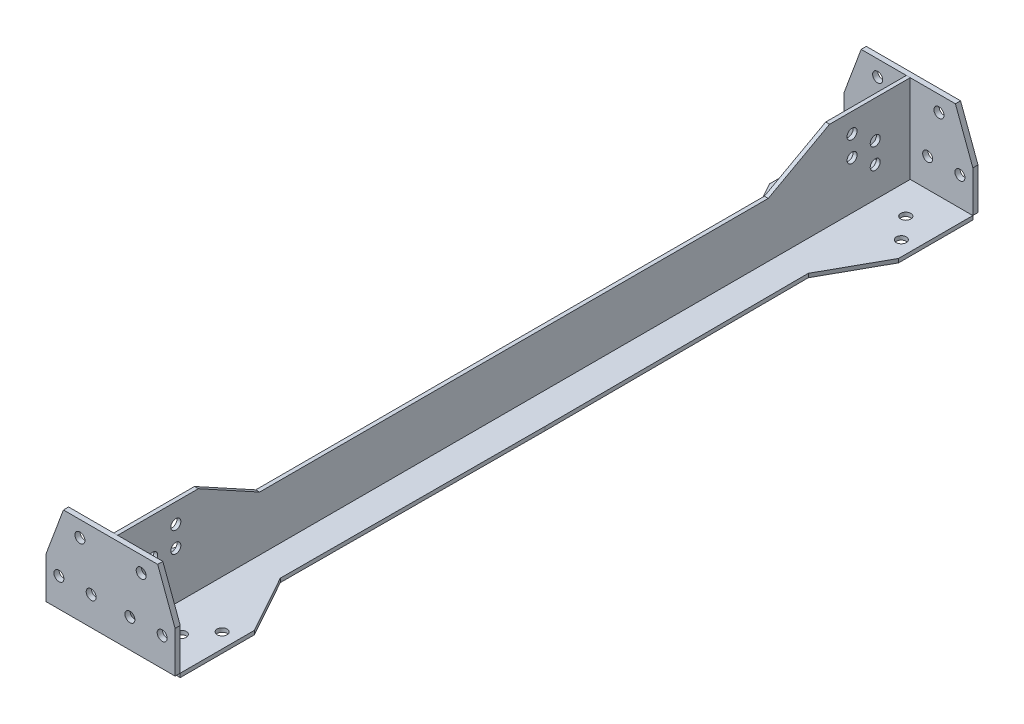
from build123d import *

# Parameters (mm, degrees)
EXTRUDE_1_DEPTH     = 1228
EXTRUDE_2_DEPTH     = 16
SKETCH_5_R          = 15.5
CUT_EXTRUDE_3_DEPTH = 1290.210999022
SKETCH_6_R          = 15.5
CUT_EXTRUDE_4_DEPTH = 1292.438345412
SKETCH_7_R          = 15.5
CUT_EXTRUDE_6_DEPTH = 1291.494866321


with BuildPart() as part:
    # 草图2 → 拉伸1 (new body)
    with BuildSketch(Plane.XY):
        Polygon((-200, -6), (200, -6), (200, 6), (6, 6), (6, 279), (-6, 279), (-6, 6), (-200, 6), align=None)
    extrude(amount=EXTRUDE_1_DEPTH)

    # 草图5 → 拉伸3 (cut, through all)
    with BuildSketch(Plane(origin=(0, 6, 0), x_dir=(-1, 0, 0), z_dir=(0, 1, 0))):
        with Locations((-97.738221798, 1122.413652083)):
            Circle(SKETCH_5_R)
        with Locations((-154.125657451, 1052.267682131)):
            Circle(SKETCH_5_R)
        with Locations((154.125657451, 1052.267682131)):
            Circle(SKETCH_5_R)
        with Locations((97.738221798, 1122.413652083)):
            Circle(SKETCH_5_R)
        Polygon((-200, 0), (-200, 998), (-100, 818), (-103, 0), align=None)
        Polygon((200, 998), (100, 818), (103, 0), (200, 0), align=None)
    extrude(amount=-CUT_EXTRUDE_3_DEPTH, mode=Mode.SUBTRACT)

    # 草图6 → 拉伸4 (cut, through all)
    with BuildSketch(Plane(origin=(6, 0, 0), x_dir=(0, 0, -1), z_dir=(1, 0, 0))):
        with Locations(Location((-1119.516620303, 164.02067953, 0), (0, 0, 90))):
            Circle(SKETCH_6_R)
        with Locations(Location((-1047.699285862, 218.263379258, 0), (0, 0, 90))):
            Circle(SKETCH_6_R)
        with Locations(Location((-1119.516620303, 100.02067953, 0), (0, 0, 90))):
            Circle(SKETCH_6_R)
        with Locations(Location((-1047.699285862, 154.263379258, 0), (0, 0, 90))):
            Circle(SKETCH_6_R)
        Polygon((-978, 279), (-788, 175), (0, 175), (0, 279), align=None)
    extrude(amount=-CUT_EXTRUDE_4_DEPTH, mode=Mode.SUBTRACT)

    # 镜向1: part across plane


with BuildPart() as body_2:
    # 草图4 → 拉伸2 (new body)
    with BuildSketch(Plane.XY.offset(1228)):
        Polygon((-200, 6), (-6, 6), (6, 6), (200, 6), (200, 134), (146, 279), (6, 279), (-6, 279), (-146, 279), (-200, 134), align=None)
    extrude(amount=EXTRUDE_2_DEPTH)

    # 草图7 → 拉伸6 (cut, through all)
    with BuildSketch(Plane.XY):
        with Locations(Location((-95, 230, 0), (0, 0, 180))):
            Circle(SKETCH_7_R)
        with Locations(Location((-60, 95, 0), (0, 0, 180))):
            Circle(SKETCH_7_R)
        with Locations(Location((-160, 95, 0), (0, 0, 180))):
            Circle(SKETCH_7_R)
        with Locations(Location((60, 95, 0), (0, 0, 180))):
            Circle(SKETCH_7_R)
        with Locations(Location((160, 95, 0), (0, 0, 180))):
            Circle(SKETCH_7_R)
        with Locations(Location((95, 230, 0), (0, 0, 180))):
            Circle(SKETCH_7_R)
    extrude(amount=CUT_EXTRUDE_6_DEPTH, mode=Mode.SUBTRACT)


with BuildPart() as part_1:
    add(part.part)
    add(part.part.mirror(Plane.XY))


with BuildPart() as body_3:
    # 镜向2: mirrored copy
    add(body_2.part.mirror(Plane.XY))


solid = Compound([body_2.part, part_1.part, body_3.part])
